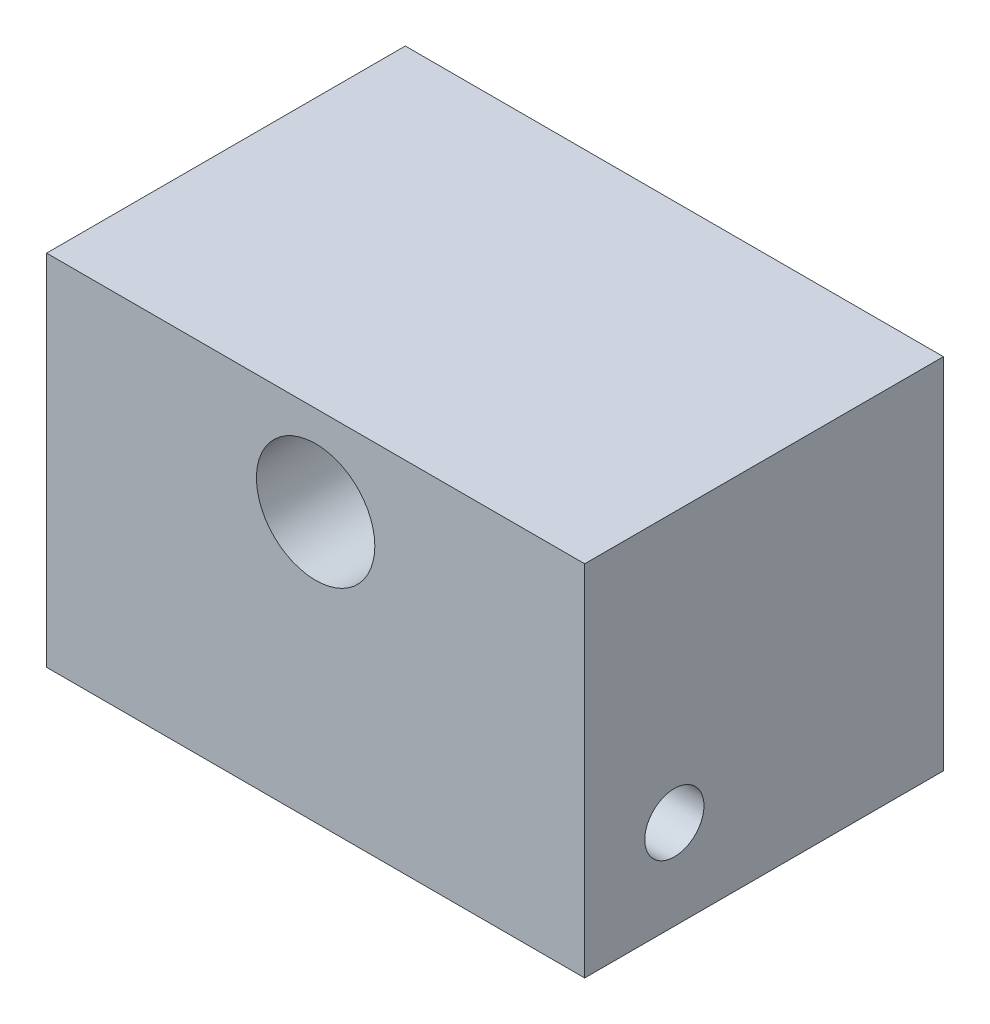
from build123d import *

# Parameters (mm, degrees)
SKIZZE1_W                       = 30
SKIZZE1_H                       = 20
AUFSATZ_LINEAR_AUSTRAGEN1_DEPTH = 20
M6_GEWINDEBOHRUNG_D             = 3.3
M6_GEWINDEBOHRUNG_DEPTH         = 10.508579979
M6_GEWINDEBOHRUNG_TIP           = 0.991420021
DURCHGANGSLOCH_F_R_M61_D        = 6.6
M4_GEWINDEBOHRUNG1_D            = 3.3
M4_GEWINDEBOHRUNG1_DEPTH        = 14.008579979
M4_GEWINDEBOHRUNG1_TIP          = 0.991420021
M4_GEWINDEBOHRUNG2_D            = 3.3
M4_GEWINDEBOHRUNG2_DEPTH        = 15
M4_GEWINDEBOHRUNG2_TIP          = 0.991420021


with BuildPart() as part:
    # Skizze1 → Aufsatz-Linear austragen1 (new body)
    with BuildSketch(Plane.XY):
        with Locations((15, 10)):
            Rectangle(SKIZZE1_W, SKIZZE1_H)
    extrude(amount=AUFSATZ_LINEAR_AUSTRAGEN1_DEPTH)

    # M6 Gewindebohrung
    with Locations(Plane(origin=(0, 0, 0), x_dir=(-1, 0, 0), z_dir=(0, -1, 0))):
        with Locations((-22.5, -7.5), (-7.5, -7.5)):
            Hole(M6_GEWINDEBOHRUNG_D / 2, depth=M6_GEWINDEBOHRUNG_DEPTH)
            with Locations((0, 0, -(M6_GEWINDEBOHRUNG_DEPTH + M6_GEWINDEBOHRUNG_TIP / 2))):  # 118° drill point
                Cone(0, M6_GEWINDEBOHRUNG_D / 2, M6_GEWINDEBOHRUNG_TIP, mode=Mode.SUBTRACT)

    # Durchgangsloch für M61 (through all)
    with Locations(Plane.XY.offset(20)):
        with Locations((15, 15)):
            Hole(DURCHGANGSLOCH_F_R_M61_D / 2)

    # M4 Gewindebohrung1
    with Locations(Plane(origin=(30, 0, 0), x_dir=(0, 0, -1), z_dir=(1, 0, 0))):
        with Locations((-15, 5)):
            Hole(M4_GEWINDEBOHRUNG1_D / 2, depth=M4_GEWINDEBOHRUNG1_DEPTH)
            with Locations((0, 0, -(M4_GEWINDEBOHRUNG1_DEPTH + M4_GEWINDEBOHRUNG1_TIP / 2))):  # 118° drill point
                Cone(0, M4_GEWINDEBOHRUNG1_D / 2, M4_GEWINDEBOHRUNG1_TIP, mode=Mode.SUBTRACT)

    # M4 Gewindebohrung2
    with Locations(Plane.ZY):
        with Locations((15, 5)):
            Hole(M4_GEWINDEBOHRUNG2_D / 2, depth=M4_GEWINDEBOHRUNG2_DEPTH)
            with Locations((0, 0, -(M4_GEWINDEBOHRUNG2_DEPTH + M4_GEWINDEBOHRUNG2_TIP / 2))):  # 118° drill point
                Cone(0, M4_GEWINDEBOHRUNG2_D / 2, M4_GEWINDEBOHRUNG2_TIP, mode=Mode.SUBTRACT)


solid = part.part
